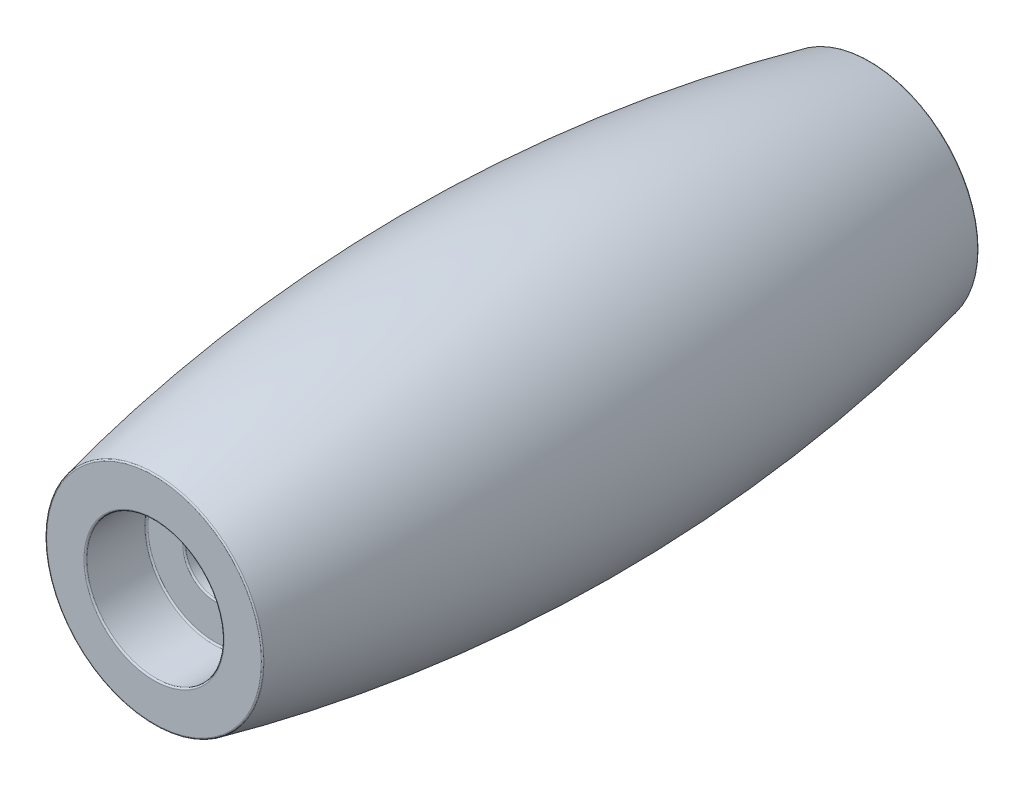
from build123d import *

# Parameters (mm, degrees)
FILLET1_R = 0.1


with BuildPart() as part:
    # Sketch1 → Revolve1 (revolve)
    with BuildSketch(Plane(origin=(0, 0, 0), x_dir=(1, 0, 0), z_dir=(0, 1, 0)), mode=Mode.PRIVATE) as revolve1_sk:
        with BuildLine():
            Line((2, 19.5), (2, -19.5))
            Line((2, -19.5), (4.5, -19.5))
            Line((4.5, -19.5), (4.5, -23.5))
            Line((4.5, -23.5), (7.125, -23.5))
            ThreePointArc((7.125, -23.5), (9.725, 0), (7.125, 23.5))
            Line((7.125, 23.5), (4.5, 23.5))
            Line((4.5, 23.5), (4.5, 19.5))
            Line((4.5, 19.5), (2, 19.5))
        make_face()
    revolve(revolve1_sk.sketch.rotate(Axis((0, 0, -23.5), (0, 0, 1)), 180), axis=Axis((0, 0, -23.5), (0, 0, 1)))

    # Fillet1
    fillet1_edges = [part.edges().sort_by_distance(p)[0] for p in [
        (4.5, 0, -19.5),
        (2, 0, -19.5),
        (2, 0, 19.5),
        (4.5, 0, 19.5),
        (4.5, 0, 23.5),
        (7.125, 0, 23.5),
        (7.125, 0, -23.5),
        (4.5, 0, -23.5),
    ]]
    fillet(fillet1_edges, radius=FILLET1_R)


solid = part.part
